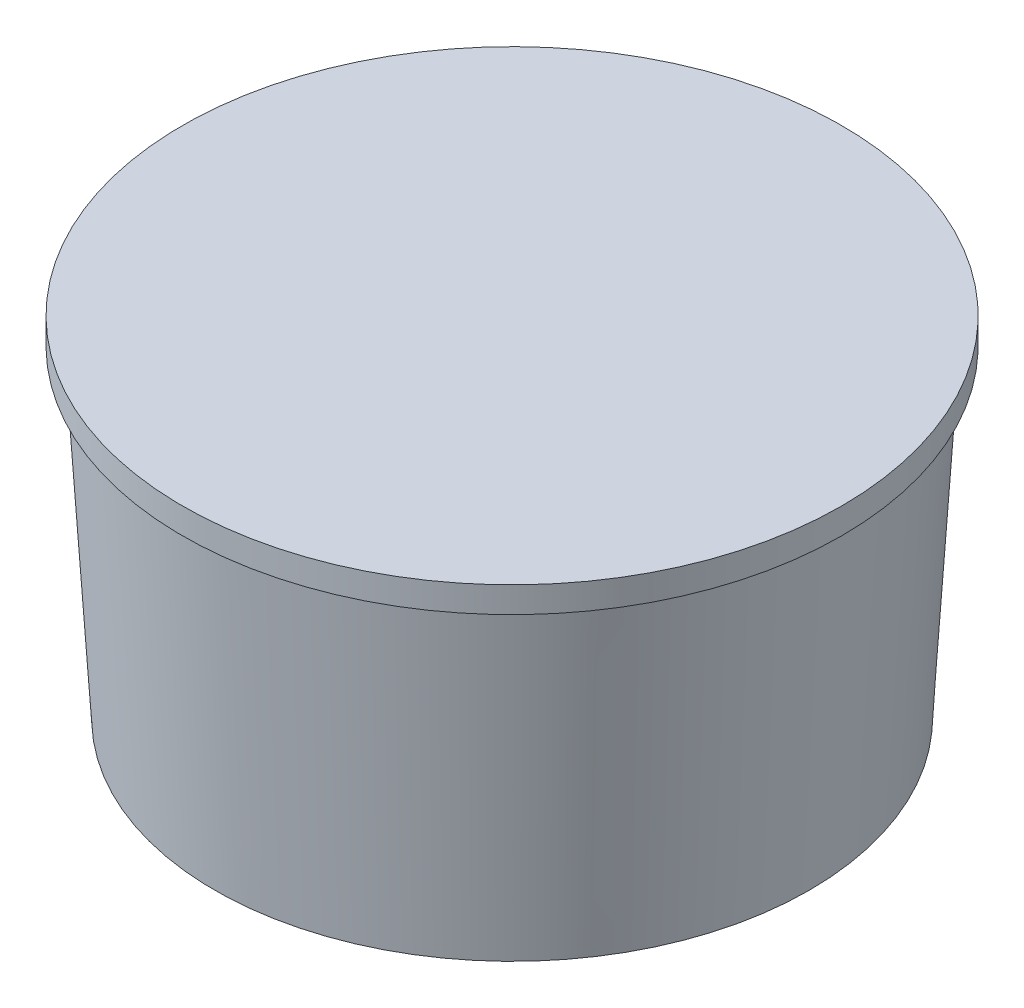
from build123d import *

# Parameters (mm, degrees)
FILLET1_R = 4


with BuildPart() as part:
    # Sketch2 → Revolve3 (revolve)
    with BuildSketch(Plane.XY):
        Polygon((22, -27), (22, -2), (0, -2), (0, 0), (25.5, 0), (25.5, -2), (24.5, -2), (23, -27), align=None)
    revolve(axis=Axis((0, -2, 0), (0, 1, 0)))

    # Fillet1
    fillet1_edges = [part.edges().sort_by_distance(p)[0] for p in [
        (-22, -2, 0),
    ]]
    fillet(fillet1_edges, radius=FILLET1_R)


solid = part.part
